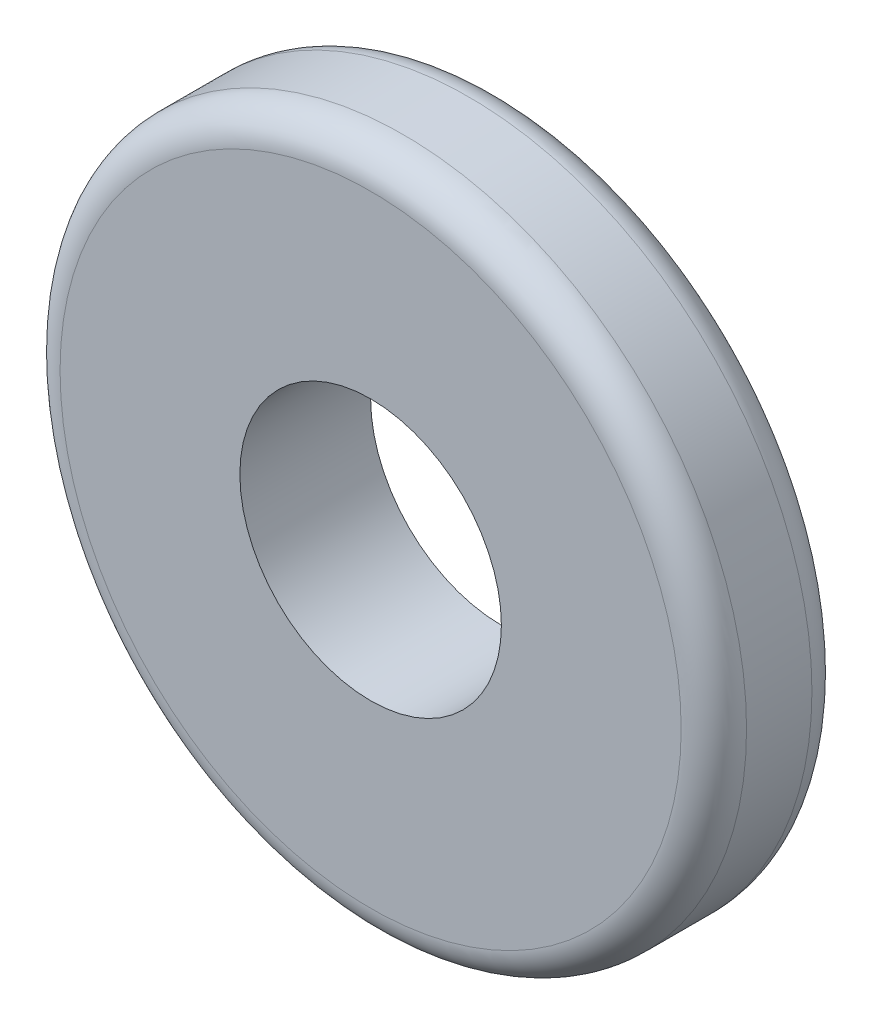
from build123d import *

# Parameters (mm, degrees)
SKETCH_1_R      = 10.5
SKETCH_1_R_2    = 4
EXTRUDE_1_DEPTH = 4
FILLET_1_R      = 1


with BuildPart() as part:
    # 草图1 → 凸台-拉伸1 (new body)
    with BuildSketch(Plane.XY):
        Circle(SKETCH_1_R)
        Circle(SKETCH_1_R_2, mode=Mode.SUBTRACT)
    extrude(amount=EXTRUDE_1_DEPTH)

    # 圆角1
    fillet_1_edges = [part.edges().sort_by_distance(p)[0] for p in [
        (-10.5, 0, 0),
        (-10.5, 0, 4),
    ]]
    fillet(fillet_1_edges, radius=FILLET_1_R)


solid = part.part
